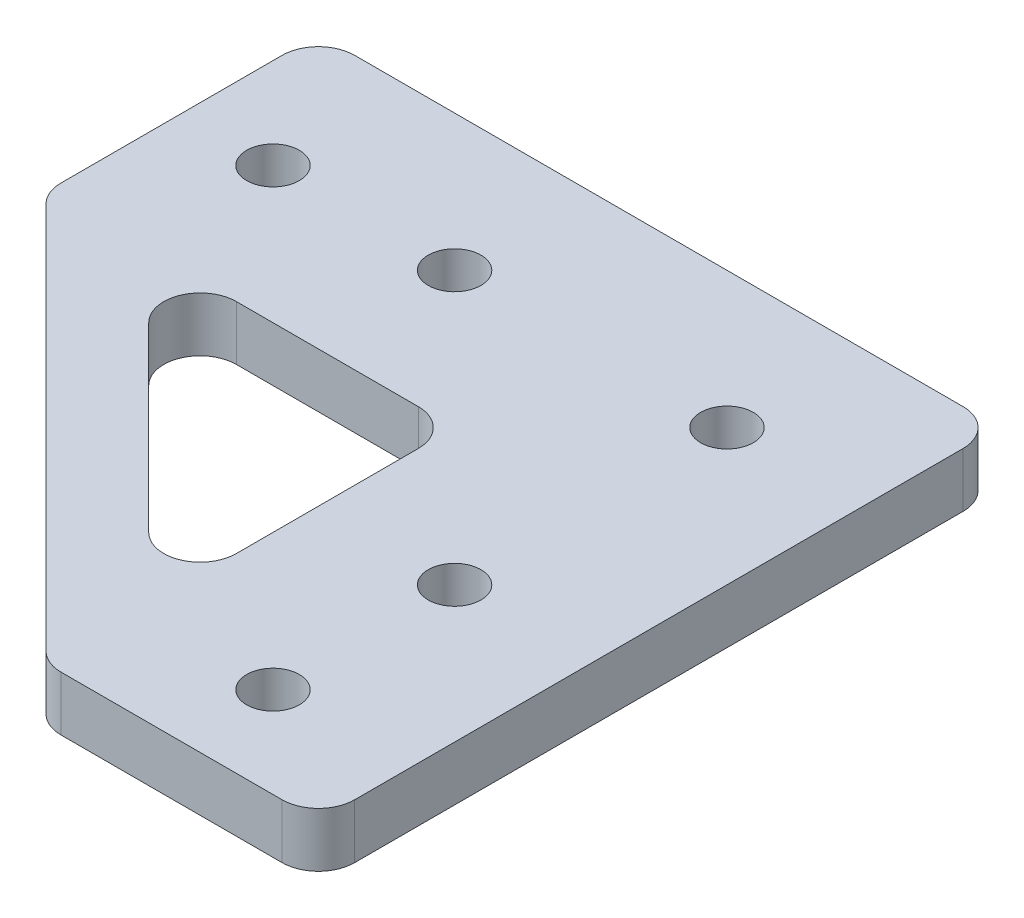
from build123d import *

# Parameters (mm, degrees)
SKETCH_1_R      = 1.45
EXTRUDE_1_DEPTH = 3
EXTRUDE_2_DEPTH = 3
FILLET_1_R      = 2


with BuildPart() as part:
    # 草图1 → 凸台-拉伸1 (new body)
    with BuildSketch(Plane(origin=(0, 0, 0), x_dir=(1, 0, 0), z_dir=(0, 1, 0))):
        Polygon((0, 0), (-37.5, 0), (-37.5, -15), (-15, -15), (-15, -37.5), (0, -37.5), align=None)
        with Locations(Location((-7.5, -7.5, 0), (0, 0, 270))):
            Circle(SKETCH_1_R, mode=Mode.SUBTRACT)
        with Locations(Location((-22.5, -7.5, 0), (0, 0, 270))):
            Circle(SKETCH_1_R, mode=Mode.SUBTRACT)
        with Locations(Location((-32.5, -7.5, 0), (0, 0, 270))):
            Circle(SKETCH_1_R, mode=Mode.SUBTRACT)
        with Locations(Location((-7.5, -22.5, 0), (0, 0, 270))):
            Circle(SKETCH_1_R, mode=Mode.SUBTRACT)
        with Locations(Location((-7.5, -32.5, 0), (0, 0, 270))):
            Circle(SKETCH_1_R, mode=Mode.SUBTRACT)
    extrude(amount=EXTRUDE_1_DEPTH)

    # 草图2 → 凸台-拉伸2 (add)
    with BuildSketch(Plane(origin=(0, 3, 0), x_dir=(1, 0, 0), z_dir=(0, 1, 0))):
        Polygon((-37.5, -15), (-15, -37.5), (-15, -31.843145751), (-31.843145751, -15), align=None)
    extrude(amount=-EXTRUDE_2_DEPTH)

    # 圆角1
    fillet_1_edges = [part.edges().sort_by_distance(p)[0] for p in [
        (0, 1.5, 37.5),
        (-15, 1.5, 37.5),
        (-15, 1.5, 15),
        (-37.5, 1.5, 15),
        (-37.5, 1.5, 0),
        (0, 1.5, 0),
        (-31.843145751, 1.5, 15),
        (-15, 1.5, 31.843145751),
    ]]
    fillet(fillet_1_edges, radius=FILLET_1_R)


solid = part.part
